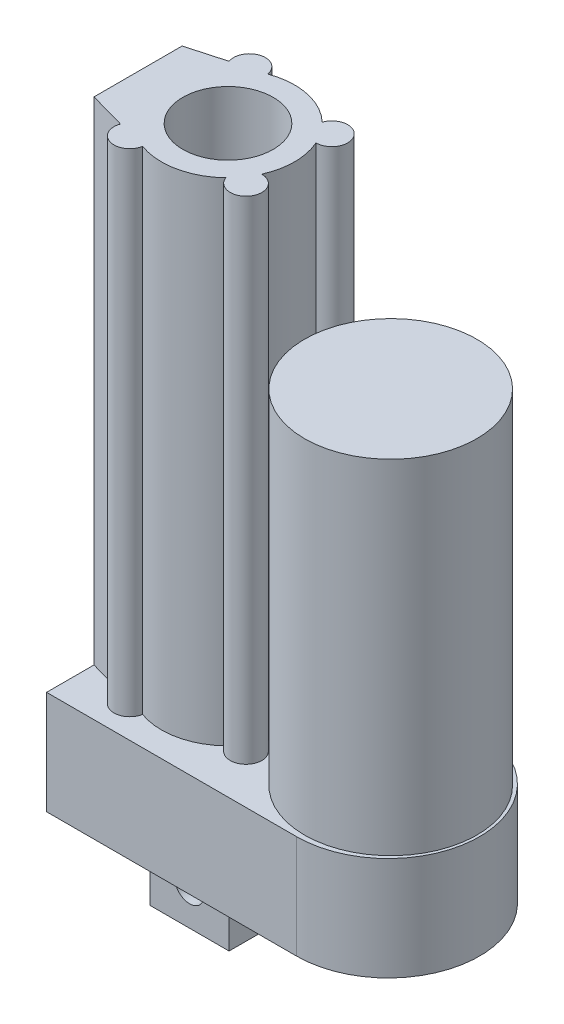
from build123d import *

# Parameters (mm, degrees)
BOSS_EXTRUDE1_DEPTH = 108.9
SKETCH2_R           = 19.075
BOSS_EXTRUDE2_DEPTH = 76
BOSS_EXTRUDE3_DEPTH = 22.9
SKETCH4_W           = 17.5
SKETCH4_H           = 17.5
BOSS_EXTRUDE4_DEPTH = 18
SKETCH5_R           = 3.25
CUT_EXTRUDE1_DEPTH  = 17.5
SKETCH6_R           = 10
CUT_EXTRUDE2_DEPTH  = 79


with BuildPart() as part:
    # Sketch1 → Boss-Extrude1 (new body)
    with BuildSketch(Plane(origin=(0, 0, 0), x_dir=(1, 0, 0), z_dir=(0, 1, 0))):
        with BuildLine():
            ThreePointArc((10.190041387, 10.664218515), (3.028324854, 14.435780151), (-5.045314834, 13.860277711))
            ThreePointArc((-5.045314834, 13.860277711), (-9.413082328, 16.626544393), (-11.770381199, 12.025156963))
            Line((-11.770381199, 12.025156963), (-19.909262437, 9.75))
            Line((-19.909262437, 9.75), (-19.909262437, -9.75))
            Line((-19.909262437, -9.75), (-11.770381199, -12.025156963))
            ThreePointArc((-11.770381199, -12.025156963), (-9.413082328, -16.626544393), (-5.045314834, -13.860277711))
            ThreePointArc((-5.045314834, -13.860277711), (3.028324854, -14.435780151), (10.190041387, -10.664218515))
            ThreePointArc((10.190041387, -10.664218515), (16.352409168, -11.515151515), (13.474496198, -6.000037683))
            ThreePointArc((13.474496198, -6.000037683), (14.75, 0), (13.474496198, 6.000037683))
            ThreePointArc((13.474496198, 6.000037683), (16.352409168, 11.515151515), (10.190041387, 10.664218515))
        make_face()
    extrude(amount=BOSS_EXTRUDE1_DEPTH)



with BuildPart() as body_2:
    # Sketch2 → Boss-Extrude2 (new body)
    with BuildSketch(Plane(origin=(0, 0, 0), x_dir=(1, 0, 0), z_dir=(0, 1, 0))):
        with Locations(Location((36.015737563, 0, 0), (0, 0, 270))):
            Circle(SKETCH2_R)
    extrude(amount=BOSS_EXTRUDE2_DEPTH)


with BuildPart() as part_1:
    add(part.part)

    add(body_2.part)  # Boss-Extrude3 merges body 2
    # Sketch3 → Boss-Extrude3 (add)
    with BuildSketch(Plane(origin=(0, 0, 0), x_dir=(1, 0, 0), z_dir=(0, 1, 0))):
        with BuildLine():
            Line((-19.909262437, 20.25), (-19.909262437, -20.25))
            Line((-19.909262437, -20.25), (35.440737563, -20.25))
            ThreePointArc((35.440737563, -20.25), (55.690737563, 0), (35.440737563, 20.25))
            Line((35.440737563, 20.25), (-19.909262437, 20.25))
        make_face()
    extrude(amount=-BOSS_EXTRUDE3_DEPTH)

    # Sketch4 → Boss-Extrude4 (add)
    with BuildSketch(Plane.XZ.offset(22.9)):
        with Locations((0.240737563, 0)):
            Rectangle(SKETCH4_W, SKETCH4_H)
    extrude(amount=BOSS_EXTRUDE4_DEPTH)

    # Sketch5 → Cut-Extrude1 (cut)
    with BuildSketch(Plane(origin=(0, 0, -8.75), x_dir=(-1, 0, 0), z_dir=(0, 0, -1))):
        with Locations((-0.240737563, -32.95)):
            Circle(SKETCH5_R)
    extrude(amount=-CUT_EXTRUDE1_DEPTH, mode=Mode.SUBTRACT)

    # Sketch6 → Cut-Extrude2 (cut)
    with BuildSketch(Plane(origin=(0, 108.9, 0), x_dir=(1, 0, 0), z_dir=(0, 1, 0))):
        with Locations(Location((0, 0, 0), (0, 0, 270))):
            Circle(SKETCH6_R)
    extrude(amount=-CUT_EXTRUDE2_DEPTH, mode=Mode.SUBTRACT)


solid = part_1.part
